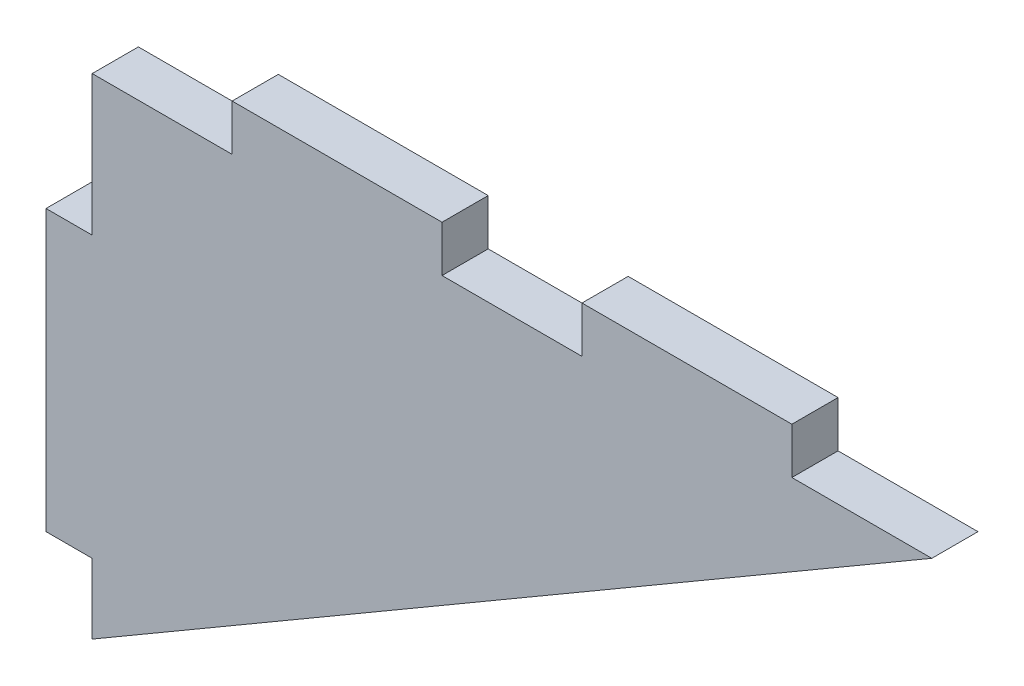
from build123d import *

# Parameters (mm, degrees)
BOSS_EXTRUDE1_DEPTH = 3.3


with BuildPart() as part:
    # Sketch1 → Boss-Extrude1 (new body)
    with BuildSketch(Plane.XY):
        Polygon((-30, -17.5), (30, 17.5), (20, 17.5), (20, 20.8), (5, 20.8), (5, 17.5), (-5, 17.5), (-5, 20.8), (-20, 20.8), (-20, 17.5), (-30, 17.5), (-30, 7.5), (-33.3, 7.5), (-33.3, -12.5), (-30, -12.5), align=None)
    extrude(amount=BOSS_EXTRUDE1_DEPTH)


solid = part.part
